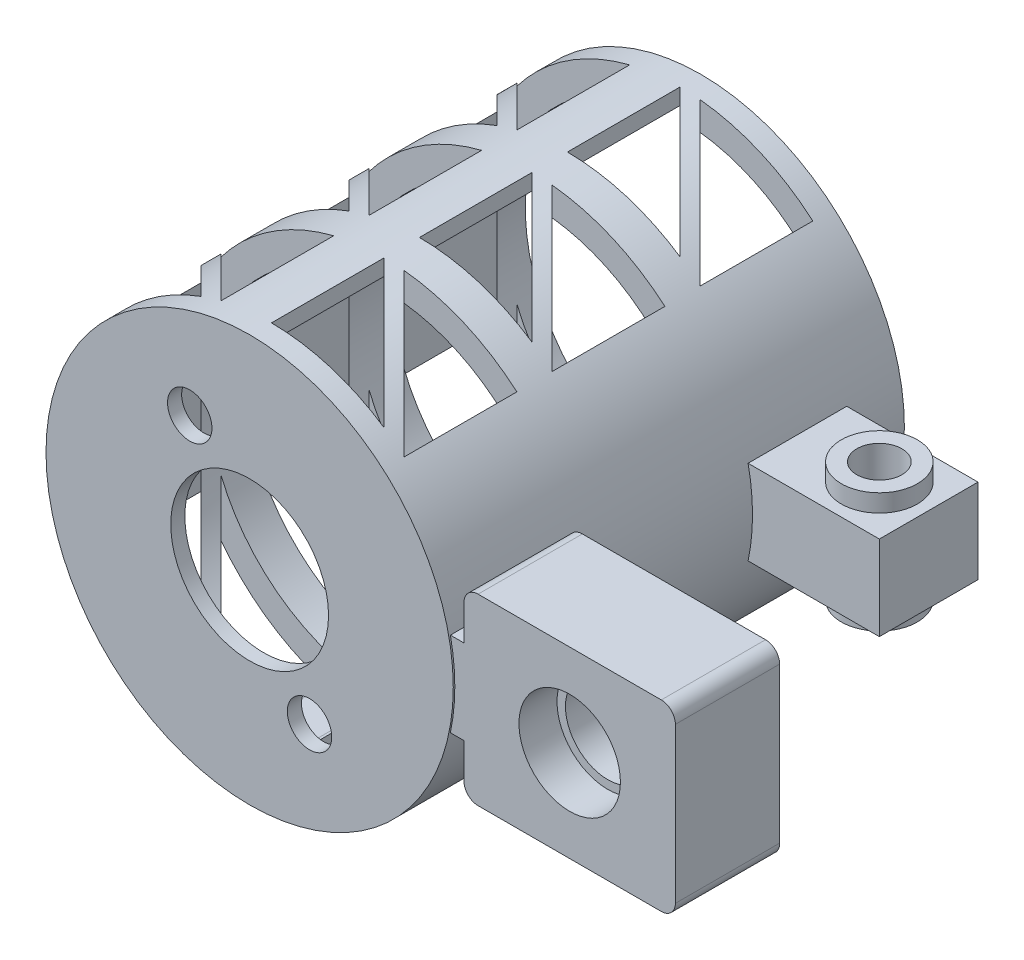
from build123d import *

# Parameters (mm, degrees)
ESQUISSE1_R                       = 14.45
ESQUISSE1_R_2                     = 12.45
BOSS_EXTRU_1_DEPTH                = 31.01
ESQUISSE2_R                       = 14.45
ESQUISSE2_R_2                     = 12.45
ESQUISSE2_R_3                     = 5.6
BOSS_EXTRU_2_DEPTH                = 1
BOSS_EXTRU_6_DEPTH                = 3
BOSS_EXTRU_6_DEPTH_BACK           = 3
ESQUISSE8_W                       = 15
ESQUISSE8_H                       = 7.4
BOSS_EXTRU_7_DEPTH                = 3.5
ESQUISSE9_R                       = 3.6
ENL_V_MAT_EXTRU_2_DEPTH           = 2.7
ENL_V_START                       = -2.7
ESQUISSE10_R                      = 3.6
ENL_V_MAT_EXTRU_3_DEPTH           = 2.7
ESQUISSE11_R                      = 3
ENL_V_MAT_EXTRU_4_DEPTH           = 44.065676588
CONG_2_R                          = 1
BOSS_EXTRU_8_DEPTH                = 3
BOSS_EXTRU_8_DEPTH_BACK           = 3
ESQUISSE13_W                      = 10
ESQUISSE13_H                      = 7
ESQUISSE14_R                      = 1.6
ENL_V_MAT_EXTRU_6_DEPTH           = 48.277400521
BOSS_EXTRU_9_START                = 1.25
ESQUISSE15_R                      = 2.7
ESQUISSE15_R_2                    = 1.6
BOSS_EXTRU_9_DEPTH                = 1.25
ESQUISSE16_R                      = 1.575
ENL_V_MAT_EXTRU_7_DEPTH           = 10
R_P_TITION_CIRCULAIRE2_COUNT      = 2
ENL_V_MAT_EXTRU_8_DEPTH           = 47.254217105
R_P_TITION_LIN_AIRE1_COUNT        = 3
R_P_TITION_LIN_AIRE1_PITCH        = 10.5
R_P_TITION_LIN_AIRE2_COUNT        = 2
R_P_TITION_LIN_AIRE2_PITCH        = 13
R_P_TITION_LIN_AIRE2_COPY_1_DEPTH = 47.254217105
R_P_TITION_LIN_AIRE2_COPY_2_DEPTH = 47.254217105
ENL_V_MAT_EXTRU_9_REACH           = 48.254
R_P_TITION_CIRCULAIRE3_COUNT      = 4
R_P_TITION_CIRCULAIRE3_ANGLE      = 195


with BuildPart() as part:
    # Esquisse1 → Boss.-Extru.1 (new body)
    with BuildSketch(Plane.XY):
        Circle(ESQUISSE1_R)
        Circle(ESQUISSE1_R_2, mode=Mode.SUBTRACT)
    extrude(amount=BOSS_EXTRU_1_DEPTH)

    # Esquisse2 → Boss.-Extru.2 (add)
    # profile 1 of 2: a face of its own
    with BuildSketch(Plane.XY.offset(31.01)):
        Circle(ESQUISSE2_R)
        Circle(ESQUISSE2_R_2, mode=Mode.SUBTRACT)
    # profile 2 of 2: a face of its own
    with BuildSketch(Plane.XY.offset(31.01)):
        Circle(ESQUISSE2_R_2)
        Circle(ESQUISSE2_R_3, mode=Mode.SUBTRACT)
    extrude(amount=BOSS_EXTRU_2_DEPTH)

    # Esquisse7 → Boss.-Extru.6 (add, two sides: drawn at the far end of the back side and taken through both)
    with BuildSketch(Plane(origin=(0, 0, 0), x_dir=(1, 0, 0), z_dir=(0, 1, 0)).offset(-BOSS_EXTRU_6_DEPTH_BACK)):
        Polygon((15.1, -24.5), (30.1, -24.5), (30.1, -31.9), (15.1, -31.9), (13.630038582, -31.9), (13.630038582, -24.5), align=None)
    extrude(amount=BOSS_EXTRU_6_DEPTH + BOSS_EXTRU_6_DEPTH_BACK)

    # Esquisse8 → Boss.-Extru.7 (add)
    with BuildSketch(Plane(origin=(0, 3, 0), x_dir=(1, 0, 0), z_dir=(0, 1, 0))):
        with Locations((22.6, -28.2)):
            Rectangle(ESQUISSE8_W, ESQUISSE8_H)
    boss_extru_7 = extrude(amount=BOSS_EXTRU_7_DEPTH)

    # Symétrie1: Boss.-Extru.7 across plane
    add(boss_extru_7.mirror(Plane.ZX))

    # Esquisse9 → Enlèv. mat.-Extru.2 (cut)
    with BuildSketch(Plane(origin=(0, 0, 24.5), x_dir=(-1, 0, 0), z_dir=(0, 0, -1))):
        with Locations((-22.6, 0)):
            Circle(ESQUISSE9_R)
    extrude(amount=-ENL_V_MAT_EXTRU_2_DEPTH, mode=Mode.SUBTRACT)

    # Esquisse10 → Enlèv. mat.-Extru.3 (cut)
    with BuildSketch(Plane.XY.offset(31.9).offset(ENL_V_START)):
        with Locations(Location((22.6, 0, 0), (0, 0, 180))):
            Circle(ESQUISSE10_R)
    extrude(amount=ENL_V_MAT_EXTRU_3_DEPTH, mode=Mode.SUBTRACT)

    # Esquisse11 → Enlèv. mat.-Extru.4 (cut, through all)
    with BuildSketch(Plane(origin=(0, 0, 27.2), x_dir=(-1, 0, 0), z_dir=(0, 0, -1))):
        with Locations((-22.6, 0)):
            Circle(ESQUISSE11_R)
    extrude(amount=-ENL_V_MAT_EXTRU_4_DEPTH, mode=Mode.SUBTRACT)

    # Congé2
    cong_2_edges = [part.edges().sort_by_distance(p)[0] for p in [
        (30.1, 6.5, 28.2),
        (15.1, 6.5, 28.2),
        (15.1, -6.5, 28.2),
        (30.1, -6.5, 28.2),
    ]]
    fillet(cong_2_edges, radius=CONG_2_R)

    # Esquisse13 → Boss.-Extru.8 (add, two sides: drawn at the far end of the back side and taken through both)
    with BuildSketch(Plane(origin=(0, 0, 0), x_dir=(1, 0, 0), z_dir=(0, 1, 0)).offset(-BOSS_EXTRU_8_DEPTH_BACK)):
        with Locations((18.45, -7.27643751)):
            Rectangle(ESQUISSE13_W, ESQUISSE13_H)
    extrude(amount=BOSS_EXTRU_8_DEPTH + BOSS_EXTRU_8_DEPTH_BACK)

    # Esquisse14 → Enlèv. mat.-Extru.6 (cut, through all)
    with BuildSketch(Plane.XZ.offset(3)):
        with Locations(Location((19.95, 7.27643751, 0), (0, 0, 270))):
            Circle(ESQUISSE14_R)
    extrude(amount=-ENL_V_MAT_EXTRU_6_DEPTH, mode=Mode.SUBTRACT)

    # Esquisse15 → Boss.-Extru.9 (add)
    with BuildSketch(Plane.XZ.offset(3).offset(BOSS_EXTRU_9_START)):
        with Locations(Location((19.95, 7.27643751, 0), (0, 0, 270))):
            Circle(ESQUISSE15_R)
        with Locations(Location((19.95, 7.27643751, 0), (0, 0, 270))):
            Circle(ESQUISSE15_R_2, mode=Mode.SUBTRACT)
    boss_extru_9 = extrude(amount=-BOSS_EXTRU_9_DEPTH)

    # Symétrie2: Boss.-Extru.9 across plane
    add(boss_extru_9.mirror(Plane.ZX))

    # Esquisse16 → Enlèv. mat.-Extru.7 (cut)
    with BuildSketch(Plane.XY.offset(32.01)):
        with Locations((4.25, -7.361215932)):
            Circle(ESQUISSE16_R)
    enl_v_mat_extru_7 = extrude(amount=-ENL_V_MAT_EXTRU_7_DEPTH, mode=Mode.SUBTRACT)

    # Répétition circulaire2: Enlèv. mat.-Extru.7 ×2 about axis
    r_p_tition_circulaire2_axis = Axis((0, 0, 0), (0, 0, 1))
    for i in range(1, R_P_TITION_CIRCULAIRE2_COUNT):
        add(enl_v_mat_extru_7.rotate(r_p_tition_circulaire2_axis, i * 360 / R_P_TITION_CIRCULAIRE2_COUNT), mode=Mode.SUBTRACT)

    # Esquisse17 → Enlèv. mat.-Extru.8 (cut, symmetric)
    with BuildSketch(Plane(origin=(0, 0, 0), x_dir=(1, 0, 0), z_dir=(0, 1, 0))):
        Polygon((-12.95, -30.51), (-12.95, -22.51), (-4.95, -30.51), align=None)
        Polygon((-11.535786438, -22.51), (-3.535786438, -30.51), (-3.535786438, -22.51), align=None)
    enl_v_mat_extru_8 = extrude(amount=ENL_V_MAT_EXTRU_8_DEPTH, both=True, mode=Mode.SUBTRACT)

    # Répétition linéaire1: Enlèv. mat.-Extru.8 ×3
    with Locations(*[(0, 0, -i * R_P_TITION_LIN_AIRE1_PITCH) for i in range(1, R_P_TITION_LIN_AIRE1_COUNT)]):
        add(enl_v_mat_extru_8, mode=Mode.SUBTRACT)

    # Répétition linéaire2: Enlèv. mat.-Extru.8 ×2
    with Locations(*[(i * R_P_TITION_LIN_AIRE2_PITCH, 0, 0) for i in range(1, R_P_TITION_LIN_AIRE2_COUNT)]):
        add(enl_v_mat_extru_8, mode=Mode.SUBTRACT)

    # Répétition linéaire2 copy 1 sketch → Répétition linéaire2 copy 1 (cut, symmetric)
    with BuildSketch(Plane(origin=(13, 0, -10.5), x_dir=(1, 0, 0), z_dir=(0, 1, 0))):
        Polygon((-12.95, -30.51), (-12.95, -22.51), (-4.95, -30.51), align=None)
        Polygon((-11.535786438, -22.51), (-3.535786438, -30.51), (-3.535786438, -22.51), align=None)
    extrude(amount=R_P_TITION_LIN_AIRE2_COPY_1_DEPTH, both=True, mode=Mode.SUBTRACT)

    # Répétition linéaire2 copy 2 sketch → Répétition linéaire2 copy 2 (cut, symmetric)
    with BuildSketch(Plane(origin=(13, 0, -21), x_dir=(1, 0, 0), z_dir=(0, 1, 0))):
        Polygon((-12.95, -30.51), (-12.95, -22.51), (-4.95, -30.51), align=None)
        Polygon((-11.535786438, -22.51), (-3.535786438, -30.51), (-3.535786438, -22.51), align=None)
    extrude(amount=R_P_TITION_LIN_AIRE2_COPY_2_DEPTH, both=True, mode=Mode.SUBTRACT)

    # Enlèv. mat.-Extru.9: up to this face of the body (flat: up to its plane)
    enl_v_mat_extru_9_end = Plane(part.part.faces().sort_by_distance((-12.097860823, 0, 31.01))[0])
    # Esquisse18 → Enlèv. mat.-Extru.9 (cut, up to the picked face)
    with BuildSketch(Plane(origin=(0, 0, 0), x_dir=(-1, 0, 0), z_dir=(0, 0, -1)), mode=Mode.PRIVATE) as enl_v_mat_extru_9_sk1:
        with BuildLine():
            Line((0.171712804, -11.737255623), (3.171712804, -11.737255623))
            ThreePointArc((3.171712804, -11.737255623), (3.771712804, -12.337255623), (3.171712804, -12.937255623))
            Line((3.171712804, -12.937255623), (0.171712804, -12.937255623))
            ThreePointArc((0.171712804, -12.937255623), (-0.428287196, -12.337255623), (0.171712804, -11.737255623))
        make_face()
    enl_v_mat_extru_9_tool1 = split(extrude(enl_v_mat_extru_9_sk1.sketch, amount=-ENL_V_MAT_EXTRU_9_REACH, mode=Mode.PRIVATE), bisect_by=enl_v_mat_extru_9_end, keep=Keep.BOTH, mode=Mode.PRIVATE)
    enl_v_mat_extru_9 = enl_v_mat_extru_9_tool1.solids().sort_by(Axis((-1.671713, -12.337256, 0), (0, 0, 1)))[0]
    add(enl_v_mat_extru_9, mode=Mode.SUBTRACT)

    # Répétition circulaire3: Enlèv. mat.-Extru.9 ×4 about axis
    r_p_tition_circulaire3_axis = Axis((0, 0, 0), (0, 0, 1))
    for i in range(1, R_P_TITION_CIRCULAIRE3_COUNT):
        add(enl_v_mat_extru_9.rotate(r_p_tition_circulaire3_axis, i * R_P_TITION_CIRCULAIRE3_ANGLE / (R_P_TITION_CIRCULAIRE3_COUNT - 1)), mode=Mode.SUBTRACT)


solid = part.part
